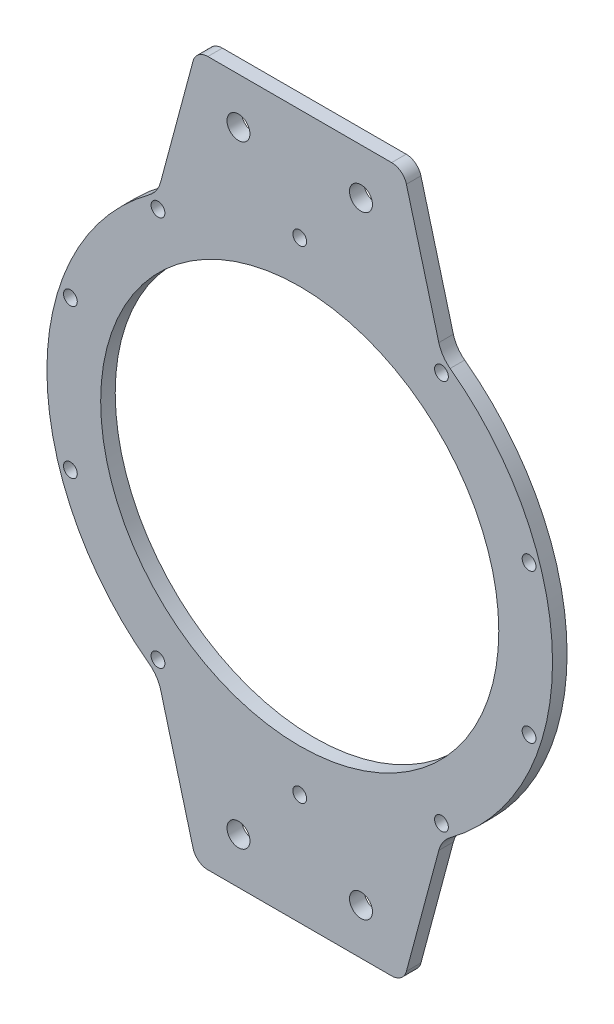
from build123d import *

# Parameters (mm, degrees)
SKETCH1_R           = 65
SKETCH1_R_2         = 3.75
SKETCH1_R_3         = 2.25
BOSS_EXTRUDE1_DEPTH = 2.3749


with BuildPart() as part:
    # Sketch1 → Boss-Extrude1 (new, symmetric)
    with BuildSketch(Plane.XY):
        with BuildLine():
            Line((-45.414170693, 71.792048343), (-34.829629131, 111.294095226))
            ThreePointArc((-34.829629131, 111.294095226), (-33.043807145, 113.966766701), (-30, 115))
            Line((-30, 115), (30, 115))
            ThreePointArc((30, 115), (33.043807145, 113.966766701), (34.829629131, 111.294095226))
            Line((34.829629131, 111.294095226), (45.414170693, 71.792048343))
            ThreePointArc((45.414170693, 71.792048343), (46.806677386, 68.753444104), (49.122761322, 66.343476093))
            ThreePointArc((49.122761322, 66.343476093), (82.55, 0), (49.122761322, -66.343476093))
            ThreePointArc((49.122761322, -66.343476093), (46.806677386, -68.753444104), (45.414170693, -71.792048343))
            Line((45.414170693, -71.792048343), (34.829629131, -111.294095226))
            ThreePointArc((34.829629131, -111.294095226), (33.043807145, -113.966766701), (30, -115))
            Line((30, -115), (-30, -115))
            ThreePointArc((-30, -115), (-33.043807145, -113.966766701), (-34.829629131, -111.294095226))
            Line((-34.829629131, -111.294095226), (-45.414170693, -71.792048343))
            ThreePointArc((-45.414170693, -71.792048343), (-46.806677386, -68.753444104), (-49.122761322, -66.343476093))
            ThreePointArc((-49.122761322, -66.343476093), (-82.55, 0), (-49.122761322, 66.343476093))
            ThreePointArc((-49.122761322, 66.343476093), (-46.806677386, 68.753444104), (-45.414170693, 71.792048343))
        make_face()
        Circle(SKETCH1_R, mode=Mode.SUBTRACT)
        with Locations((-20, 100)):
            Circle(SKETCH1_R_2, mode=Mode.SUBTRACT)
        with Locations((20, 100)):
            Circle(SKETCH1_R_2, mode=Mode.SUBTRACT)
        with Locations(Location((20, -100, 0), (0, 0, 180))):
            Circle(SKETCH1_R_2, mode=Mode.SUBTRACT)
        with Locations(Location((-20, -100, 0), (0, 0, 180))):
            Circle(SKETCH1_R_2, mode=Mode.SUBTRACT)
        with Locations((0, 78.74)):
            Circle(SKETCH1_R_3, mode=Mode.SUBTRACT)
        with Locations((46.282210766, 63.701998137)):
            Circle(SKETCH1_R_3, mode=Mode.SUBTRACT)
        with Locations((74.886190093, 24.331998137)):
            Circle(SKETCH1_R_3, mode=Mode.SUBTRACT)
        with Locations((74.886190093, -24.331998137)):
            Circle(SKETCH1_R_3, mode=Mode.SUBTRACT)
        with Locations((46.282210766, -63.701998137)):
            Circle(SKETCH1_R_3, mode=Mode.SUBTRACT)
        with Locations((0, -78.74)):
            Circle(SKETCH1_R_3, mode=Mode.SUBTRACT)
        with Locations((-46.282210766, -63.701998137)):
            Circle(SKETCH1_R_3, mode=Mode.SUBTRACT)
        with Locations((-74.886190093, -24.331998137)):
            Circle(SKETCH1_R_3, mode=Mode.SUBTRACT)
        with Locations((-74.886190093, 24.331998137)):
            Circle(SKETCH1_R_3, mode=Mode.SUBTRACT)
        with Locations((-46.282210766, 63.701998137)):
            Circle(SKETCH1_R_3, mode=Mode.SUBTRACT)
    extrude(amount=BOSS_EXTRUDE1_DEPTH, both=True)


solid = part.part
